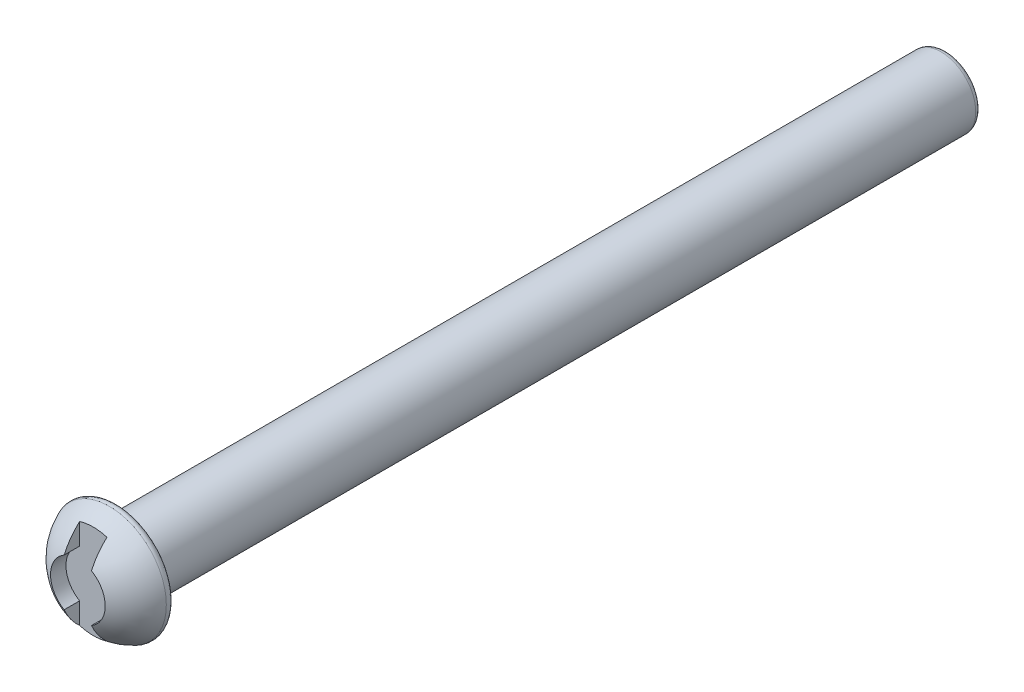
from build123d import *

# Parameters (mm, degrees)
CUT_EXTRUDE1_DEPTH = 0.6
FILLET1_R          = 0.15


with BuildPart() as part:
    # Sketch4 → Revolve2 (revolve)
    with BuildSketch(Plane(origin=(0, 0, 0), x_dir=(0, 0, -1), z_dir=(1, 0, 0))):
        with BuildLine():
            Line((0, 0), (24, 0))
            Line((24, 0), (24, 0.95))
            Line((24, 0.95), (1.25, 0.95))
            Line((1.25, 0.95), (1.25, 1.63))
            ThreePointArc((1.25, 1.63), (0.348475184, 1.027058908), (0, 0))
        make_face()
    revolve(axis=Axis((0, 0, 0), (0, 0, -1)))

    # Sketch5 → Cut-Extrude1 (cut)
    with BuildSketch(Plane.XY):
        with BuildLine():
            Line((-0.375, -0.649519053), (-0.375, -1.87097888))
            Line((-0.375, -1.87097888), (0.375, -1.87097888))
            Line((0.375, -1.87097888), (0.375, -0.649519053))
            ThreePointArc((0.375, -0.649519053), (0.75, 0), (0.375, 0.649519053))
            Line((0.375, 0.649519053), (0.375, 1.87097888))
            Line((0.375, 1.87097888), (-0.375, 1.87097888))
            Line((-0.375, 1.87097888), (-0.375, 0.649519053))
            ThreePointArc((-0.375, 0.649519053), (-0.75, 0), (-0.375, -0.649519053))
        make_face()
    extrude(amount=-CUT_EXTRUDE1_DEPTH, mode=Mode.SUBTRACT)

    # Fillet1
    fillet1_edges = [part.edges().sort_by_distance(p)[0] for p in [
        (0, -1.63, -1.25),
        (0, -0.95, -24),
    ]]
    fillet(fillet1_edges, radius=FILLET1_R)


solid = part.part
